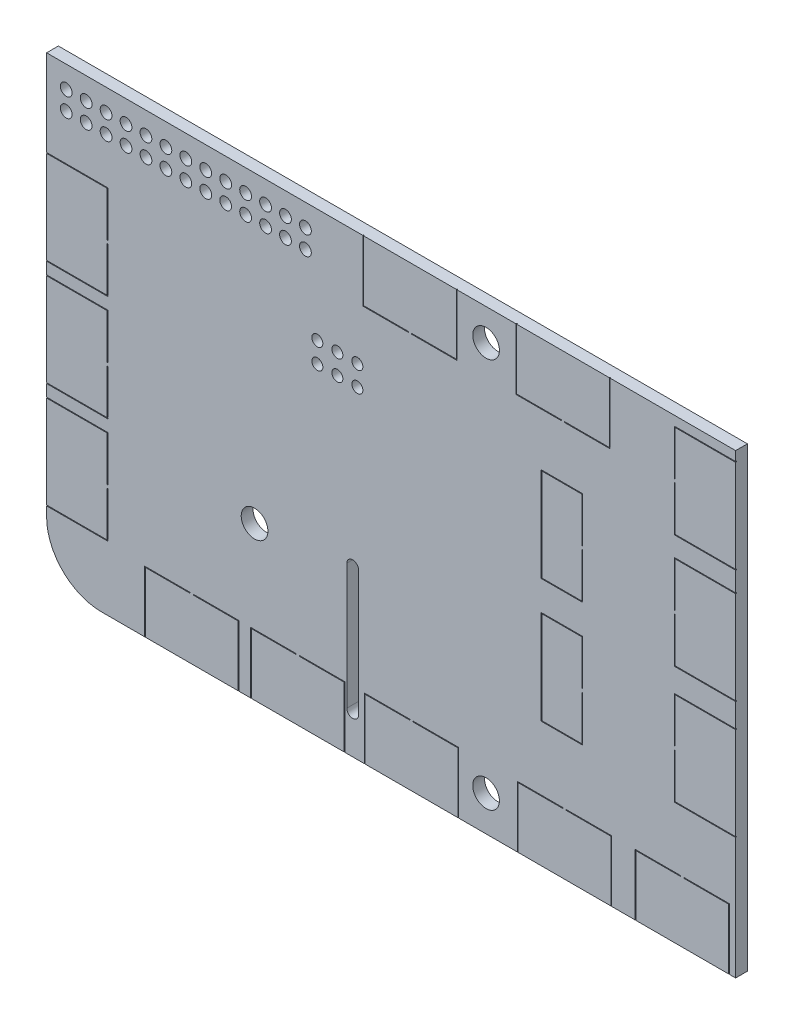
from build123d import *

# Parameters (mm, degrees)
ESQUISSE1_R                = 1.7
BOSS_EXTRU_1_DEPTH         = 1.5
ESQUISSE2_R                = 0.75
ENL_V_MAT_EXTRU_3_DEPTH    = 53.690321692
R_P_TITION_LIN_AIRE1_COUNT = 13
R_P_TITION_LIN_AIRE1_PITCH = 2.54
ESQUISSE3_R                = 0.7
ENL_V_MAT_EXTRU_4_DEPTH    = 1.5
R_P_TITION_LIN_AIRE2_COUNT = 3
R_P_TITION_LIN_AIRE2_PITCH = 2.55
ENL_V_MAT_EXTRU_8_DEPTH    = 0.1


with BuildPart() as part:
    # Esquisse1 → Boss.-Extru.1 (new body)
    with BuildSketch(Plane.XY):
        with BuildLine():
            Line((-36.9, -29.1), (43.9, -29.1))
            Line((43.9, -29.1), (43.9, 29.1))
            Line((43.9, 29.1), (-43.9, 29.1))
            Line((-43.9, 29.1), (-43.9, -22.1))
            ThreePointArc((-43.9, -22.1), (-41.849747468, -27.049747468), (-36.9, -29.1))
        make_face()
        with Locations((12.1, 25.1)):
            Circle(ESQUISSE1_R, mode=Mode.SUBTRACT)
        with Locations((-17.4, -9.6)):
            Circle(ESQUISSE1_R, mode=Mode.SUBTRACT)
        with Locations((12.1, -24.6)):
            Circle(ESQUISSE1_R, mode=Mode.SUBTRACT)
        with BuildLine():
            Line((-4.15, -8.1), (-4.15, -24.1))
            ThreePointArc((-4.15, -24.1), (-4.9, -24.85), (-5.65, -24.1))
            Line((-5.65, -24.1), (-5.65, -8.1))
            ThreePointArc((-5.65, -8.1), (-4.9, -7.35), (-4.15, -8.1))
        make_face(mode=Mode.SUBTRACT)
    extrude(amount=BOSS_EXTRU_1_DEPTH)

    # Esquisse2 → Enlèv. mat.-Extru.3 (cut, through all)
    with BuildSketch(Plane.XY):
        with Locations((-41.4, 26.3)):
            Circle(ESQUISSE2_R)
        with Locations(Location((-41.4, 23.9, 0), (0, 0, 180))):
            Circle(ESQUISSE2_R)
    enl_v_mat_extru_3 = extrude(amount=ENL_V_MAT_EXTRU_3_DEPTH, mode=Mode.SUBTRACT)

    # Répétition linéaire1: Enlèv. mat.-Extru.3 ×13
    with Locations(*[(i * R_P_TITION_LIN_AIRE1_PITCH, 0, 0) for i in range(1, R_P_TITION_LIN_AIRE1_COUNT)]):
        add(enl_v_mat_extru_3, mode=Mode.SUBTRACT)

    # Esquisse3 → Enlèv. mat.-Extru.4 (cut)
    with BuildSketch(Plane.XY.offset(1.5)):
        with Locations((-9.4, 14.6)):
            Circle(ESQUISSE3_R)
        with Locations(Location((-9.4, 12, 0), (0, 0, 180))):
            Circle(ESQUISSE3_R)
    enl_v_mat_extru_4 = extrude(amount=-ENL_V_MAT_EXTRU_4_DEPTH, mode=Mode.SUBTRACT)

    # Répétition linéaire2: Enlèv. mat.-Extru.4 ×3
    with Locations(*[(i * R_P_TITION_LIN_AIRE2_PITCH, 0, 0) for i in range(1, R_P_TITION_LIN_AIRE2_COUNT)]):
        add(enl_v_mat_extru_4, mode=Mode.SUBTRACT)

    # Esquisse5 → Enlèv. mat.-Extru.8 (cut)
    with BuildSketch(Plane.XY.offset(1.5)):
        Polygon((-46, 18), (-36.2, 18), (-36.2, 12.3), (-36.1, 12.3), (-36.1, 18.1), (-46.1, 18.1), (-46.1, 6.1), (-36.1, 6.1), (-36.1, 11.9), (-36.2, 11.9), (-36.2, 6.2), (-46, 6.2), align=None)
        Polygon((-46, 4.5), (-36.2, 4.5), (-36.2, -1.2), (-36.1, -1.2), (-36.1, 4.6), (-46.1, 4.6), (-46.1, -7.4), (-36.1, -7.4), (-36.1, -1.6), (-36.2, -1.6), (-36.2, -7.3), (-46, -7.3), align=None)
        Polygon((-46, -9), (-36.2, -9), (-36.2, -14.7), (-36.1, -14.7), (-36.1, -8.9), (-46.1, -8.9), (-46.1, -20.9), (-36.1, -20.9), (-36.1, -15.1), (-36.2, -15.1), (-36.2, -20.8), (-46, -20.8), align=None)
        Polygon((-3.4, -21.3), (2.4, -21.3), (2.4, -21.4), (-3.3, -21.4), (-3.3, -31.2), (8.5, -31.2), (8.5, -21.4), (2.8, -21.4), (2.8, -21.3), (8.6, -21.3), (8.6, -31.3), (-3.4, -31.3), align=None)
        Polygon((-31.4, -21.3), (-25.6, -21.3), (-25.6, -21.4), (-31.3, -21.4), (-31.3, -31.2), (-19.5, -31.2), (-19.5, -21.4), (-25.2, -21.4), (-25.2, -21.3), (-19.4, -21.3), (-19.4, -31.3), (-31.4, -31.3), align=None)
        Polygon((-17.9, -21.3), (-12.1, -21.3), (-12.1, -21.4), (-17.8, -21.4), (-17.8, -31.2), (-6, -31.2), (-6, -21.4), (-11.7, -21.4), (-11.7, -21.3), (-5.9, -21.3), (-5.9, -31.3), (-17.9, -31.3), align=None)
        Polygon((16.1, -21.3), (21.9, -21.3), (21.9, -21.4), (16.2, -21.4), (16.2, -31.2), (28, -31.2), (28, -21.4), (22.3, -21.4), (22.3, -21.3), (28.1, -21.3), (28.1, -31.3), (16.1, -31.3), align=None)
        Polygon((31.1, -21.3), (36.9, -21.3), (36.9, -21.4), (31.2, -21.4), (31.2, -31.2), (43, -31.2), (43, -21.4), (37.3, -21.4), (37.3, -21.3), (43.1, -21.3), (43.1, -31.3), (31.1, -31.3), align=None)
        Polygon((36.1, -7.4), (36.2, -7.4), (36.2, -1.7), (46, -1.7), (46, -13.5), (36.2, -13.5), (36.2, -7.8), (36.1, -7.8), (36.1, -13.6), (46.1, -13.6), (46.1, -1.6), (36.1, -1.6), align=None)
        Polygon((36.1, 7.6), (36.2, 7.6), (36.2, 13.3), (46, 13.3), (46, 1.5), (36.2, 1.5), (36.2, 7.2), (36.1, 7.2), (36.1, 1.4), (46.1, 1.4), (46.1, 13.4), (36.1, 13.4), align=None)
        Polygon((36.1, 22.1), (36.2, 22.1), (36.2, 27.8), (46, 27.8), (46, 16), (36.2, 16), (36.2, 21.7), (36.1, 21.7), (36.1, 15.9), (46.1, 15.9), (46.1, 27.9), (36.1, 27.9), align=None)
        Polygon((15.9, 21.3), (21.7, 21.3), (21.7, 21.4), (16, 21.4), (16, 31.2), (27.8, 31.2), (27.8, 21.4), (22.1, 21.4), (22.1, 21.3), (27.9, 21.3), (27.9, 31.3), (15.9, 31.3), align=None)
        Polygon((-3.6, 21.3), (2.2, 21.3), (2.2, 21.4), (-3.5, 21.4), (-3.5, 31.2), (8.3, 31.2), (8.3, 21.4), (2.6, 21.4), (2.6, 21.3), (8.4, 21.3), (8.4, 31.3), (-3.6, 31.3), align=None)
        Polygon((24.4, 14.6), (24.4, 8.8), (24.3, 8.8), (24.3, 14.5), (19.2, 14.5), (19.2, 2.7), (24.3, 2.7), (24.3, 8.4), (24.4, 8.4), (24.4, 2.6), (19.1, 2.6), (19.1, 14.6), align=None)
        Polygon((24.4, -1.15), (24.4, -6.95), (24.3, -6.95), (24.3, -1.25), (19.2, -1.25), (19.2, -13.05), (24.3, -13.05), (24.3, -7.35), (24.4, -7.35), (24.4, -13.15), (19.1, -13.15), (19.1, -1.15), align=None)
    extrude(amount=-ENL_V_MAT_EXTRU_8_DEPTH, mode=Mode.SUBTRACT)


solid = part.part
